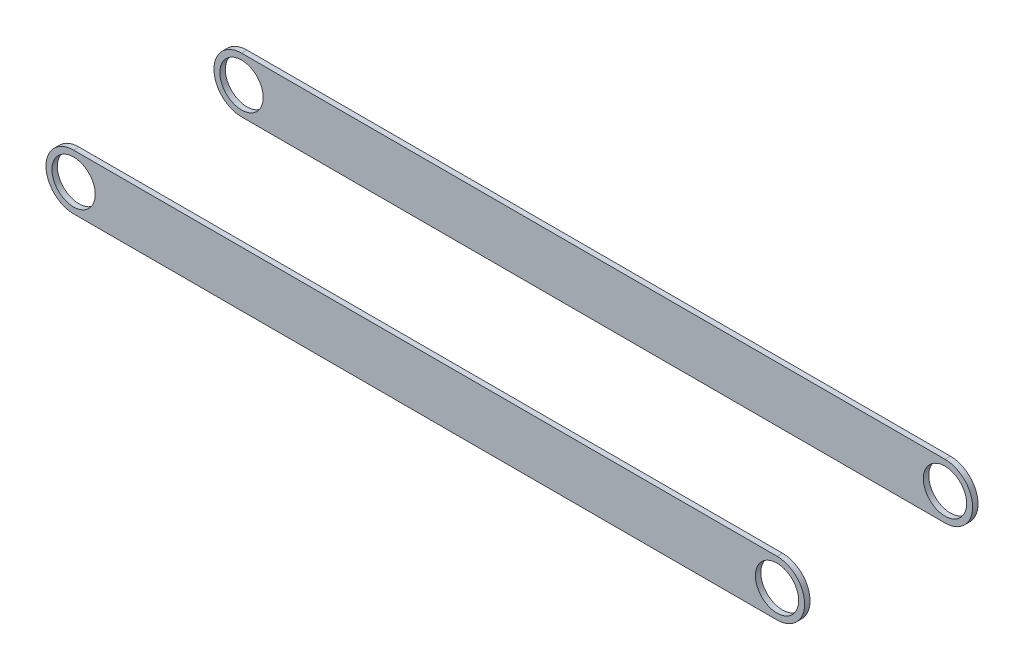
from build123d import *

# Parameters (mm, degrees)
SKETCH1_R           = 40
BOSS_EXTRUDE1_DEPTH = 10


with BuildPart() as part:
    # Sketch1 → Boss-Extrude1 (new body)
    with BuildSketch(Plane.XY):
        with BuildLine():
            Line((0, -51), (-1300, -51))
            ThreePointArc((-1300, -51), (-1351, 0), (-1300, 51))
            Line((-1300, 51), (0, 51))
            ThreePointArc((0, 51), (51, 0), (0, -51))
        make_face()
        Circle(SKETCH1_R, mode=Mode.SUBTRACT)
        with Locations((-1300, 0)):
            Circle(SKETCH1_R, mode=Mode.SUBTRACT)
    extrude(amount=BOSS_EXTRUDE1_DEPTH)


with BuildPart() as body_2:
    # Mirror5: mirrored copy
    add(part.part.mirror(Plane.XY.offset(315)))


with BuildPart() as body_2_1:
    # Move Body 1: moved
    add(body_2.part.moved(Location((0, 0, -113.8))))


with BuildPart() as part_1:
    # Move Body 2: moved
    add(part.part.moved(Location((0, 0, 113.8))))


with BuildPart() as part_2:
    # Move Body 4: moved
    add(part_1.part.moved(Location((0, 0, 41))))


with BuildPart() as body_2_2:
    # Move Body 5: moved
    add(body_2_1.part.moved(Location((0, 0, -41))))


solid = Compound([part_2.part, body_2_2.part])
